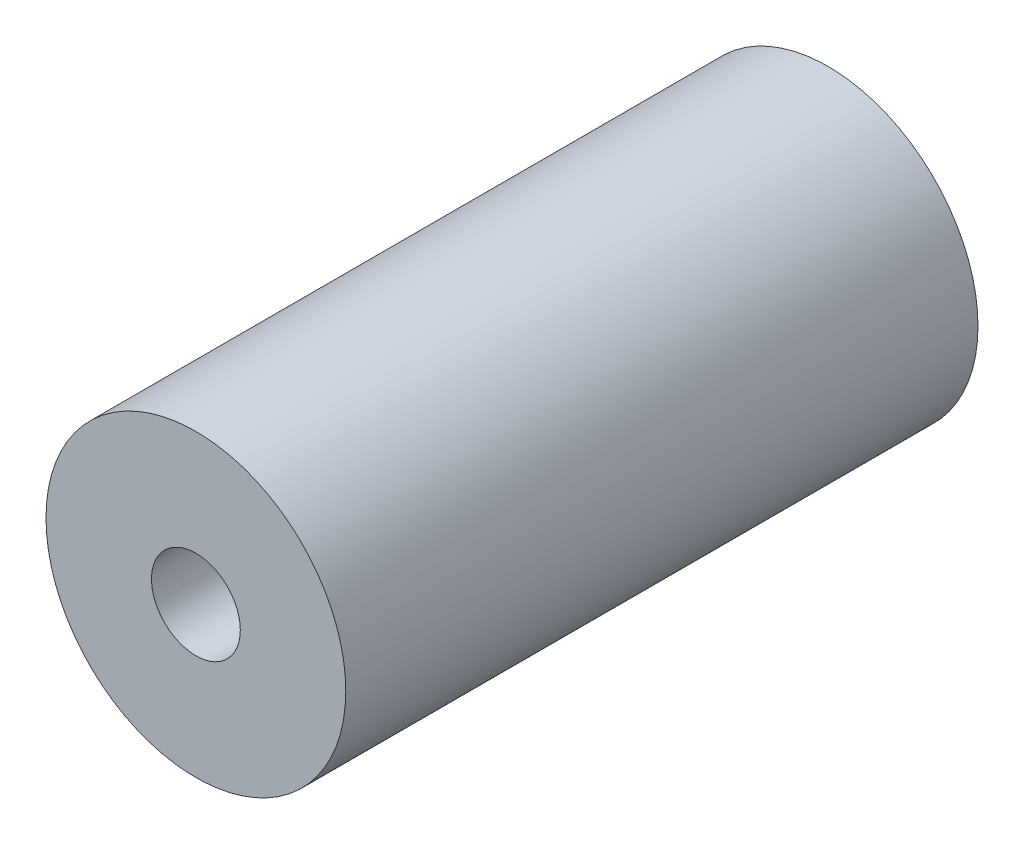
from build123d import *

# Parameters (mm, degrees)
SKETCH1_R           = 32.15
SKETCH1_R_2         = 9.525
BOSS_EXTRUDE1_DEPTH = 135.6


with BuildPart() as part:
    # Sketch1 → Boss-Extrude1 (new body)
    with BuildSketch(Plane(origin=(0, 0, 0), x_dir=(0, 1, 0), z_dir=(0, 0, 1))):
        with Locations(Location((0, 0, 0), (0, 0, 270))):
            Circle(SKETCH1_R)
        with Locations(Location((0, 0, 0), (0, 0, 270))):
            Circle(SKETCH1_R_2, mode=Mode.SUBTRACT)
    extrude(amount=BOSS_EXTRUDE1_DEPTH)


solid = part.part
